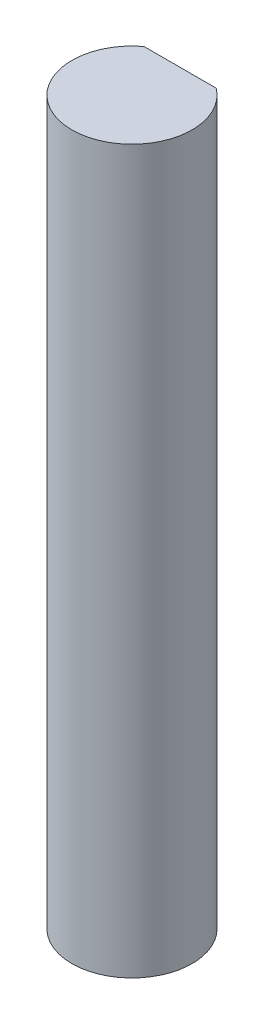
from build123d import *

# Parameters (mm, degrees)
EXTRUDE_1_DEPTH = 30


with BuildPart() as part:
    # 草图1 → 凸台-拉伸1 (new body)
    with BuildSketch(Plane(origin=(0, 0, 0), x_dir=(1, 0, 0), z_dir=(0, 1, 0))):
        with BuildLine():
            Line((0, 2), (-1.5, 2))
            ThreePointArc((-1.5, 2), (-2.371708245, -0.790569415), (0, -2.5))
            Line((0, -2.5), (0, 2))
        make_face()
        with BuildLine():
            Line((1.5, 2), (0, 2))
            Line((0, 2), (0, -2.5))
            ThreePointArc((0, -2.5), (1.767766953, -1.767766953), (2.5, 0))
            ThreePointArc((2.5, 0), (2.236067977, 1.118033989), (1.5, 2))
        make_face()
    extrude(amount=EXTRUDE_1_DEPTH)


solid = part.part
